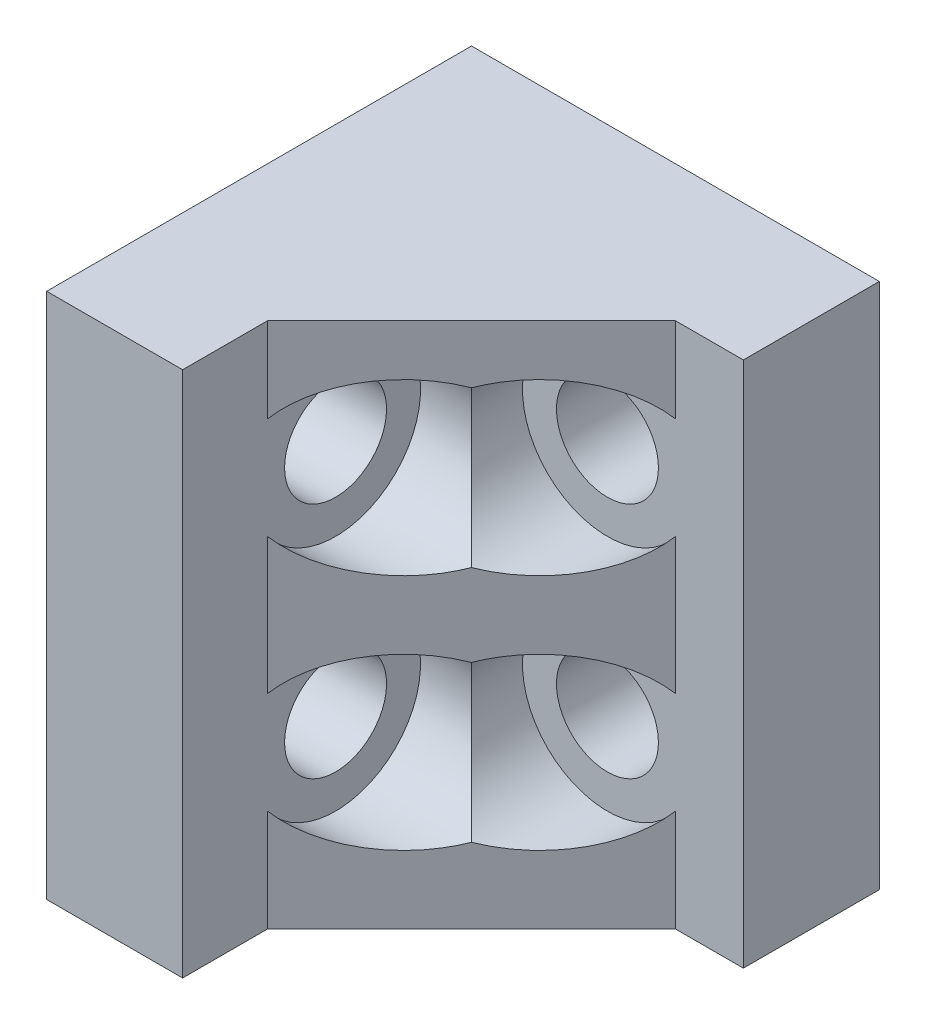
from build123d import *

# Parameters (mm, degrees)
SKETCH1_W           = 12
SKETCH1_H           = 15.5
BOSS_EXTRUDE1_DEPTH = 4
SKETCH2_W           = 4
SKETCH2_H           = 15.5
BOSS_EXTRUDE2_DEPTH = 8.5
SKETCH3_R           = 1.5
CUT_EXTRUDE1_DEPTH  = 5
SKETCH4_R           = 1.5
CUT_EXTRUDE2_DEPTH  = 5
BOSS_EXTRUDE3_DEPTH = 15.5
SKETCH6_R           = 2.5
CUT_EXTRUDE3_DEPTH  = 8
SKETCH7_R           = 2.5
CUT_EXTRUDE4_DEPTH  = 8.5


with BuildPart() as part:
    # Sketch1 → Boss-Extrude1 (new body)
    with BuildSketch(Plane.XY):
        with Locations((7.780385216, 28.096978354)):
            Rectangle(SKETCH1_W, SKETCH1_H)
    extrude(amount=BOSS_EXTRUDE1_DEPTH)

    # Sketch2 → Boss-Extrude2 (add)
    with BuildSketch(Plane.XY.offset(4)):
        with Locations((3.780385216, 28.096978354)):
            Rectangle(SKETCH2_W, SKETCH2_H)
    extrude(amount=BOSS_EXTRUDE2_DEPTH)

    # Sketch3 → Cut-Extrude1 (cut)
    with BuildSketch(Plane(origin=(5.780385216, 0, 0), x_dir=(0, 0, -1), z_dir=(1, 0, 0))):
        with Locations((-8, 24.846978354)):
            Circle(SKETCH3_R)
        with Locations((-8, 31.846978354)):
            Circle(SKETCH3_R)
    extrude(amount=-CUT_EXTRUDE1_DEPTH, mode=Mode.SUBTRACT)

    # Sketch4 → Cut-Extrude2 (cut)
    with BuildSketch(Plane.XY.offset(4)):
        with Locations((9.780385216, 24.846978354)):
            Circle(SKETCH4_R)
        with Locations((9.780385216, 31.846978354)):
            Circle(SKETCH4_R)
    extrude(amount=-CUT_EXTRUDE2_DEPTH, mode=Mode.SUBTRACT)

    # Sketch5 → Boss-Extrude3 (add)
    with BuildSketch(Plane(origin=(0, 35.846978354, 0), x_dir=(1, 0, 0), z_dir=(0, 1, 0))):
        Polygon((5.780385216, -4), (5.780385216, -10), (11.780385216, -4), align=None)
    extrude(amount=-BOSS_EXTRUDE3_DEPTH)

    # Sketch6 → Cut-Extrude3 (cut)
    with BuildSketch(Plane(origin=(13.780385216, 0, 0), x_dir=(0, 0, -1), z_dir=(1, 0, 0))):
        with Locations((-8, 31.846978354)):
            Circle(SKETCH6_R)
        with Locations((-8, 24.846978354)):
            Circle(SKETCH6_R)
    extrude(amount=-CUT_EXTRUDE3_DEPTH, mode=Mode.SUBTRACT)

    # Sketch7 → Cut-Extrude4 (cut)
    with BuildSketch(Plane.XY.offset(12.5)):
        with Locations((9.780385216, 31.846978354)):
            Circle(SKETCH7_R)
        with Locations((9.780385216, 24.846978354)):
            Circle(SKETCH7_R)
    extrude(amount=-CUT_EXTRUDE4_DEPTH, mode=Mode.SUBTRACT)


solid = part.part
